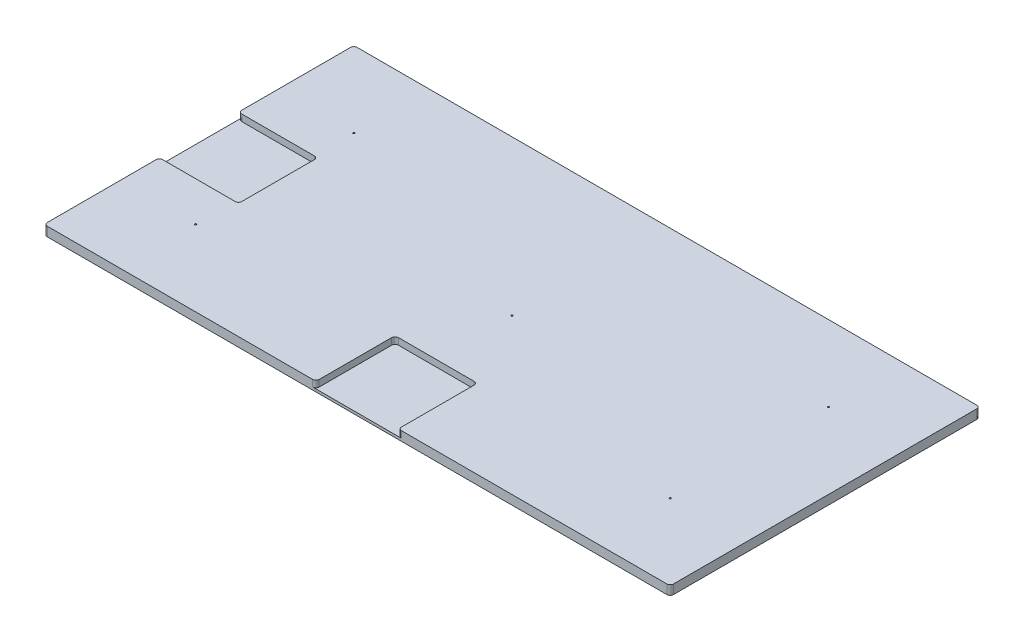
from build123d import *

# Parameters (mm, degrees)
SKETCH1_W                    = 1206.5
SKETCH1_H                    = 596.9
BOSS_EXTRUDE1_DEPTH          = 17.78
F_1_8_0_125_DIAMETER_HOLE1_D = 3.175
FILLET1_R                    = 6.35
SKETCH4_W                    = 158.75
SKETCH4_H                    = 152.4
SKETCH4_W_2                  = 152.4
CUT_EXTRUDE1_DEPTH           = 12.7
FILLET2_R                    = 6.35


with BuildPart() as part:
    # Sketch1 → Boss-Extrude1 (new body)
    with BuildSketch(Plane(origin=(0, 0, 0), x_dir=(1, 0, 0), z_dir=(0, 1, 0))):
        Rectangle(SKETCH1_W, SKETCH1_H)
    extrude(amount=BOSS_EXTRUDE1_DEPTH)

    # 1/8 (0.125) Diameter Hole1 (through all)
    with Locations(Plane(origin=(0, 17.78, 0), x_dir=(1, 0, 0), z_dir=(0, 1, 0))):
        with Locations((0, 0), (457.2, 152.4), (-457.2, -152.4), (-457.2, 152.4), (457.2, -152.4)):
            Hole(F_1_8_0_125_DIAMETER_HOLE1_D / 2)

    # Fillet1
    fillet1_edges = [part.edges().sort_by_distance(p)[0] for p in [
        (603.25, 8.89, 298.45),
        (-603.25, 8.89, 298.45),
        (-603.25, 8.89, -298.45),
        (603.25, 8.89, -298.45),
    ]]
    fillet(fillet1_edges, radius=FILLET1_R)

    # Sketch4 → Cut-Extrude1 (cut)
    with BuildSketch(Plane(origin=(0, 17.78, 0), x_dir=(1, 0, 0), z_dir=(0, 1, 0))):
        with Locations((0, -222.25)):
            Rectangle(SKETCH4_W, SKETCH4_H)
        with Locations((-527.05, 0)):
            Rectangle(SKETCH4_W_2, SKETCH4_H)
    extrude(amount=-CUT_EXTRUDE1_DEPTH, mode=Mode.SUBTRACT)

    # Fillet2
    fillet2_edges = [part.edges().sort_by_distance(p)[0] for p in [
        (79.375, 11.43, 146.05),
        (79.375, 11.43, 298.45),
        (-79.375, 11.43, 298.45),
        (-79.375, 11.43, 146.05),
        (-603.25, 11.43, 76.2),
        (-603.25, 11.43, -76.2),
        (-450.85, 11.43, -76.2),
        (-450.85, 11.43, 76.2),
    ]]
    fillet(fillet2_edges, radius=FILLET2_R)


solid = part.part
